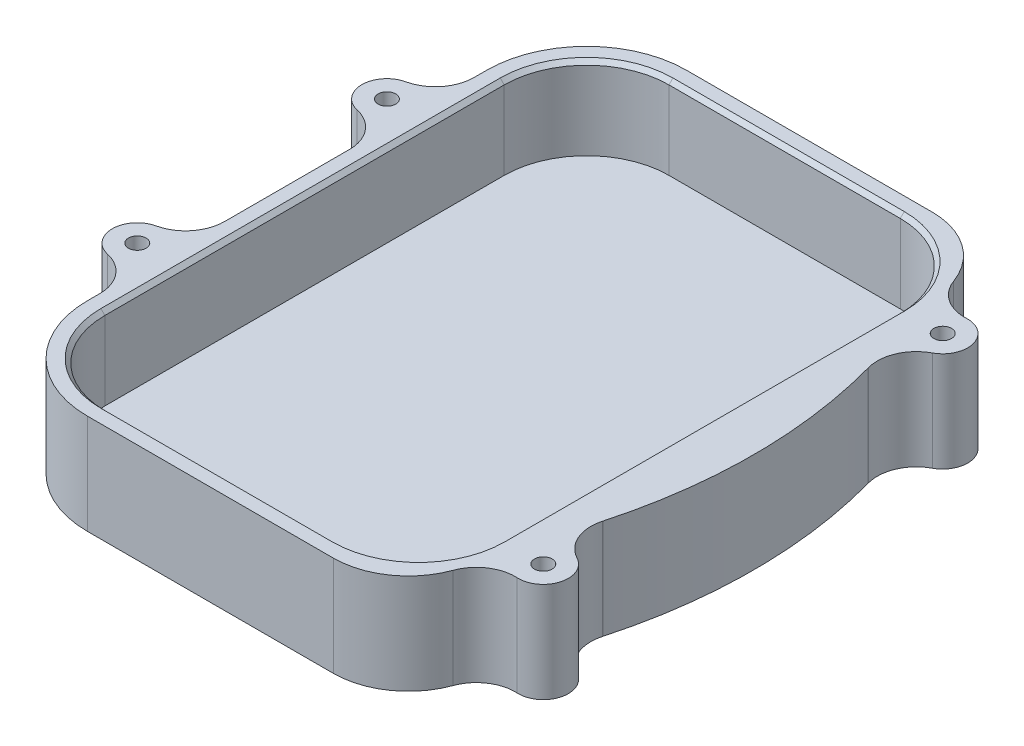
from build123d import *

# Parameters (mm, degrees)
SKETCH1_W           = 137.16
SKETCH1_H           = 152.4
BOSS_EXTRUDE2_DEPTH = 25.4
CUT_EXTRUDE1_DEPTH  = 25.4
SKETCH2_R           = 2.2479
CUT_EXTRUDE2_DEPTH  = 25.4
FILLET2_R           = 25.4
FILLET3_R           = 19.05
FILLET4_R           = 127
CUT_EXTRUDE3_DEPTH  = 20.955
CHAMFER1_SIZE       = 1.016


with BuildPart() as part:
    # Sketch1 → Boss-Extrude2 (new body)
    with BuildSketch(Plane(origin=(0, 0, 0), x_dir=(1, 0, 0), z_dir=(0, 1, 0))):
        Rectangle(SKETCH1_W, SKETCH1_H)
    extrude(amount=-BOSS_EXTRUDE2_DEPTH)

    # Sketch3 → Cut-Extrude1 (cut)
    with BuildSketch(Plane(origin=(0, 0, 0), x_dir=(1, 0, 0), z_dir=(0, 1, 0))):
        with BuildLine():
            Line((68.58, 0), (59.262686671, -33.820874717))
            ThreePointArc((59.262686671, -33.820874717), (59.713399713, -40.366937171), (64.156526503, -45.195259885))
            ThreePointArc((64.156526503, -45.195259885), (67.293603318, -52.486532428), (60.865154116, -57.142598053))
            ThreePointArc((60.865154116, -57.142598053), (54.576224637, -59.014346409), (50.836773359, -64.406060426))
            Line((50.836773359, -64.406060426), (47.587660753, -76.2))
            Line((47.587660753, -76.2), (68.58, -76.2))
            Line((68.58, -76.2), (68.58, 0))
        make_face()
        with BuildLine():
            Line((-54.821666667, -47.612294916), (-54.821666667, -76.2))
            Line((-54.821666667, -76.2), (-68.58, -76.2))
            Line((-68.58, -76.2), (-68.58, 0))
            Line((-68.58, 0), (-54.821666667, 0))
            Line((-54.821666667, 0), (-54.821666667, -15.887705084))
            ThreePointArc((-54.821666667, -15.887705084), (-56.994797895, -22.078955084), (-62.560729167, -25.553791048))
            ThreePointArc((-62.560729167, -25.553791048), (-67.521666667, -31.75), (-62.560729167, -37.946208952))
            ThreePointArc((-62.560729167, -37.946208952), (-56.994797895, -41.421044916), (-54.821666667, -47.612294916))
        make_face()
    cut_extrude1 = extrude(amount=-CUT_EXTRUDE1_DEPTH, mode=Mode.SUBTRACT)

    # Mirror1: Cut-Extrude1 across plane
    add(cut_extrude1.mirror(Plane(origin=(-54.821666667, -104.438713977, 0), x_dir=(1, 0, 0), z_dir=(0, 0, -1))), mode=Mode.SUBTRACT)

    # Sketch2 → Cut-Extrude2 (cut)
    with BuildSketch(Plane(origin=(0, 0, 0), x_dir=(1, 0, 0), z_dir=(0, 1, 0))):
        with Locations(Location((-61.171666667, 31.75, 0), (0, 0, 270))):
            Circle(SKETCH2_R)
        with Locations(Location((-61.171666667, -31.75, 0), (0, 0, 270))):
            Circle(SKETCH2_R)
        with Locations(Location((61.171666667, 50.8, 0), (0, 0, 270))):
            Circle(SKETCH2_R)
        with Locations(Location((61.171666667, -50.8, 0), (0, 0, 270))):
            Circle(SKETCH2_R)
    extrude(amount=-CUT_EXTRUDE2_DEPTH, mode=Mode.SUBTRACT)

    # Fillet2
    fillet2_edges = [part.edges().sort_by_distance(p)[0] for p in [
        (-54.821666667, -12.7, 76.2),
        (-54.821666667, -12.7, -76.2),
    ]]
    fillet(fillet2_edges, radius=FILLET2_R)

    # Fillet3
    fillet3_edges = [part.edges().sort_by_distance(p)[0] for p in [
        (47.587660753, -12.7, 76.2),
        (47.587660753, -12.7, -76.2),
    ]]
    fillet(fillet3_edges, radius=FILLET3_R)

    # Fillet4
    fillet4_edges = [part.edges().sort_by_distance(p)[0] for p in [
        (68.58, -12.7, 0),
    ]]
    fillet(fillet4_edges, radius=FILLET4_R)

    # Sketch4 → Cut-Extrude3 (cut)
    with BuildSketch(Plane(origin=(0, 0, 0), x_dir=(1, 0, 0), z_dir=(0, 1, 0))):
        with BuildLine():
            Line((-50.376666667, 50.8), (-50.376666667, -50.8))
            ThreePointArc((-50.376666667, -50.8), (-44.239089266, -65.6174226), (-29.421666667, -71.755))
            Line((-29.421666667, -71.755), (29.421666667, -71.755))
            ThreePointArc((29.421666667, -71.755), (44.239089266, -65.6174226), (50.376666667, -50.8))
            Line((50.376666667, -50.8), (50.376666667, 50.8))
            ThreePointArc((50.376666667, 50.8), (44.239089266, 65.6174226), (29.421666667, 71.755))
            Line((29.421666667, 71.755), (-29.421666667, 71.755))
            ThreePointArc((-29.421666667, 71.755), (-44.239089266, 65.6174226), (-50.376666667, 50.8))
        make_face()
    extrude(amount=-CUT_EXTRUDE3_DEPTH, mode=Mode.SUBTRACT)

    # Chamfer1
    chamfer1_edges = [part.edges().sort_by_distance(p)[0] for p in [
        (44.239089266, 0, 65.6174226),
        (50.376666667, 0, 0),
        (44.239089266, 0, -65.6174226),
        (0, 0, -71.755),
        (-44.239089266, 0, -65.6174226),
        (-50.376666667, 0, 0),
        (-44.239089266, 0, 65.6174226),
        (0, 0, 71.755),
    ]]
    chamfer(chamfer1_edges, length=CHAMFER1_SIZE)


solid = part.part
